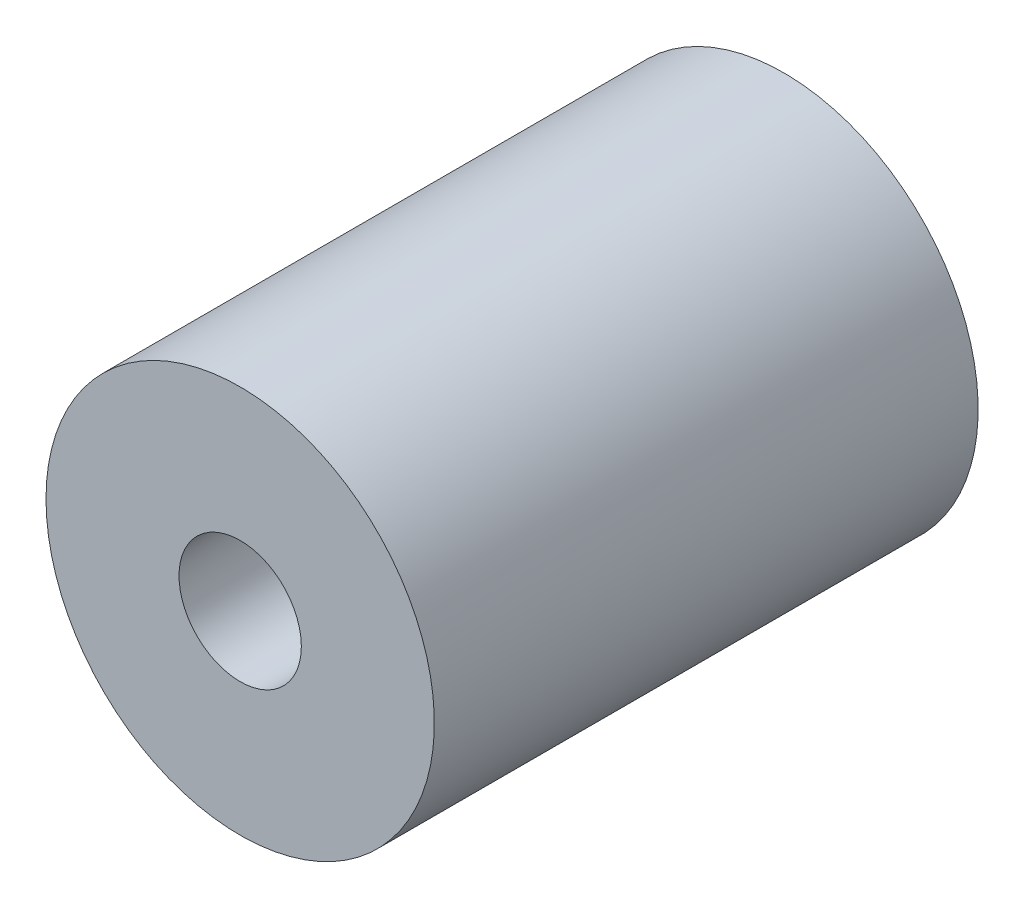
from build123d import *

# Parameters (mm, degrees)
SKETCH1_R           = 9.525
BOSS_EXTRUDE1_DEPTH = 26.675
SKETCH2_R           = 3
CUT_EXTRUDE1_DEPTH  = 30.883220626


with BuildPart() as part:
    # Sketch1 → Boss-Extrude1 (new body)
    with BuildSketch(Plane.XY):
        with Locations(Location((0, 0, 0), (0, 0, 180))):
            Circle(SKETCH1_R)
    extrude(amount=BOSS_EXTRUDE1_DEPTH)

    # Sketch2 → Cut-Extrude1 (cut, through all)
    with BuildSketch(Plane.XY.offset(26.675)):
        Circle(SKETCH2_R)
    extrude(amount=-CUT_EXTRUDE1_DEPTH, mode=Mode.SUBTRACT)


solid = part.part
